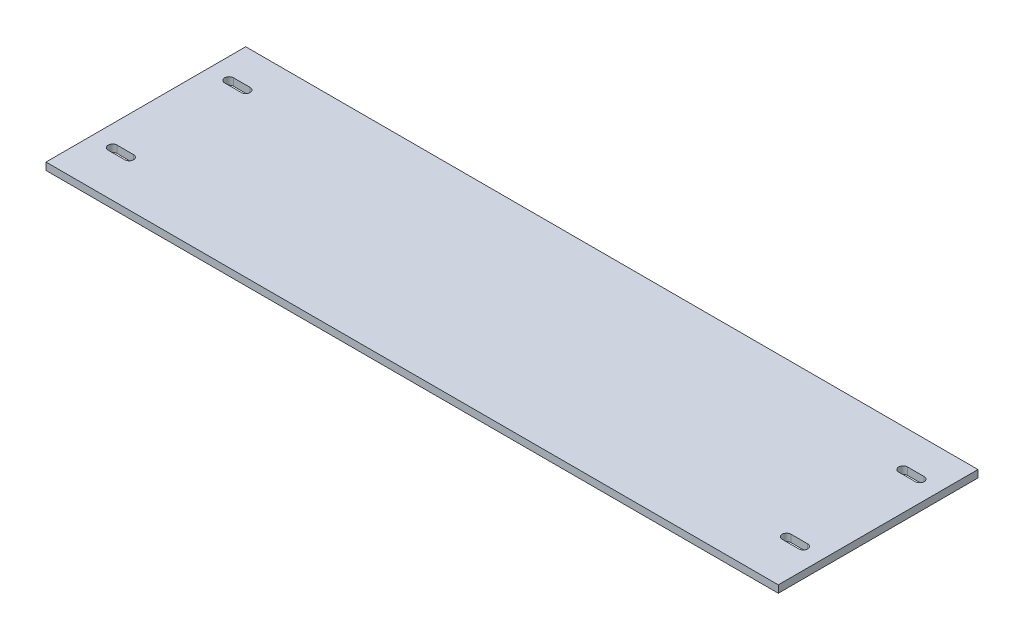
from build123d import *

# Parameters (mm, degrees)
SKETCH1_W           = 558.8
SKETCH1_H           = 152.4
BOSS_EXTRUDE1_DEPTH = 5.588


with BuildPart() as part:
    # Sketch1 → Boss-Extrude1 (new body)
    with BuildSketch(Plane(origin=(0, 0, 0), x_dir=(1, 0, 0), z_dir=(0, 1, 0))):
        with Locations((279.4, 76.2)):
            Rectangle(SKETCH1_W, SKETCH1_H)
        with BuildLine():
            Line((15.875, 38.3032), (28.575, 38.3032))
            ThreePointArc((28.575, 38.3032), (31.9532, 34.925), (28.575, 31.5468))
            Line((28.575, 31.5468), (15.875, 31.5468))
            ThreePointArc((15.875, 31.5468), (12.4968, 34.925), (15.875, 38.3032))
        make_face(mode=Mode.SUBTRACT)
        with BuildLine():
            Line((15.875, 127.2032), (28.575, 127.2032))
            ThreePointArc((28.575, 127.2032), (31.9532, 123.825), (28.575, 120.4468))
            Line((28.575, 120.4468), (15.875, 120.4468))
            ThreePointArc((15.875, 120.4468), (12.4968, 123.825), (15.875, 127.2032))
        make_face(mode=Mode.SUBTRACT)
        with BuildLine():
            Line((542.925, 120.4468), (530.225, 120.4468))
            ThreePointArc((530.225, 120.4468), (526.8468, 123.825), (530.225, 127.2032))
            Line((530.225, 127.2032), (542.925, 127.2032))
            ThreePointArc((542.925, 127.2032), (546.3032, 123.825), (542.925, 120.4468))
        make_face(mode=Mode.SUBTRACT)
        with BuildLine():
            Line((542.925, 31.5468), (530.225, 31.5468))
            ThreePointArc((530.225, 31.5468), (526.8468, 34.925), (530.225, 38.3032))
            Line((530.225, 38.3032), (542.925, 38.3032))
            ThreePointArc((542.925, 38.3032), (546.3032, 34.925), (542.925, 31.5468))
        make_face(mode=Mode.SUBTRACT)
    extrude(amount=BOSS_EXTRUDE1_DEPTH)


solid = part.part
